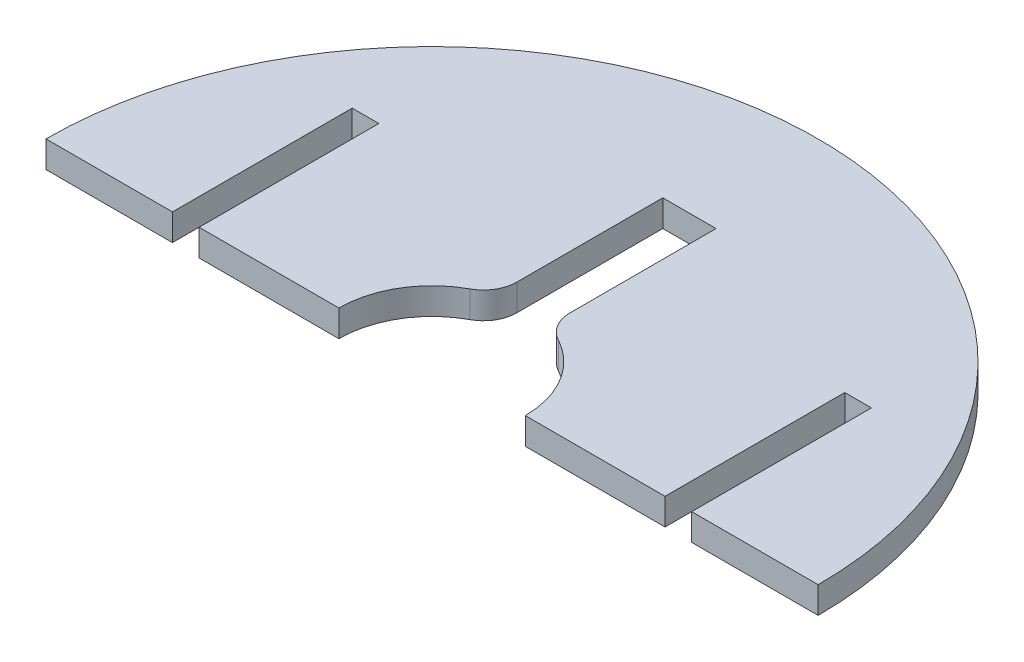
from build123d import *

# Parameters (mm, degrees)
BOSS_EXTRUDE1_DEPTH = 4
SKETCH2_W           = 4
SKETCH2_H           = 27
CUT_EXTRUDE1_DEPTH  = 83.121860671
CUT_EXTRUDE2_DEPTH  = 83.121860671


with BuildPart() as part:
    # Sketch1 → Boss-Extrude1 (new body)
    with BuildSketch(Plane(origin=(0, 0, 0), x_dir=(1, 0, 0), z_dir=(0, 1, 0))):
        with BuildLine():
            Line((-58, 0), (58, 0))
            ThreePointArc((58, 0), (0, 58), (-58, 0))
        make_face()
    extrude(amount=BOSS_EXTRUDE1_DEPTH)

    # Sketch2 → Cut-Extrude1 (cut, through all)
    with BuildSketch(Plane(origin=(0, 4, 0), x_dir=(1, 0, 0), z_dir=(0, 1, 0))):
        with Locations((37, 13.5)):
            Rectangle(SKETCH2_W, SKETCH2_H)
        with Locations((-37, 13.5)):
            Rectangle(SKETCH2_W, SKETCH2_H)
    extrude(amount=-CUT_EXTRUDE1_DEPTH, mode=Mode.SUBTRACT)

    # Sketch3 → Cut-Extrude2 (cut, through all)
    with BuildSketch(Plane(origin=(0, 4, 0), x_dir=(1, 0, 0), z_dir=(0, 1, 0))):
        with BuildLine():
            Line((4, 38.663200531), (0, 38.663200531))
            Line((0, 38.663200531), (0, 0))
            Line((0, 0), (14, 0))
            ThreePointArc((14, 0), (12.017531054, 7.181848465), (6.631578947, 12.329726707))
            ThreePointArc((6.631578947, 12.329726707), (4.708024624, 14.16825465), (4, 16.733200531))
            Line((4, 16.733200531), (4, 38.663200531))
        make_face()
        with BuildLine():
            Line((-4, 38.663200531), (-4, 16.733200531))
            ThreePointArc((-4, 16.733200531), (-4.708024624, 14.16825465), (-6.631578947, 12.329726707))
            ThreePointArc((-6.631578947, 12.329726707), (-12.017531054, 7.181848465), (-14, 0))
            Line((-14, 0), (0, 0))
            Line((0, 0), (0, 38.663200531))
            Line((0, 38.663200531), (-4, 38.663200531))
        make_face()
    extrude(amount=-CUT_EXTRUDE2_DEPTH, mode=Mode.SUBTRACT)


solid = part.part
